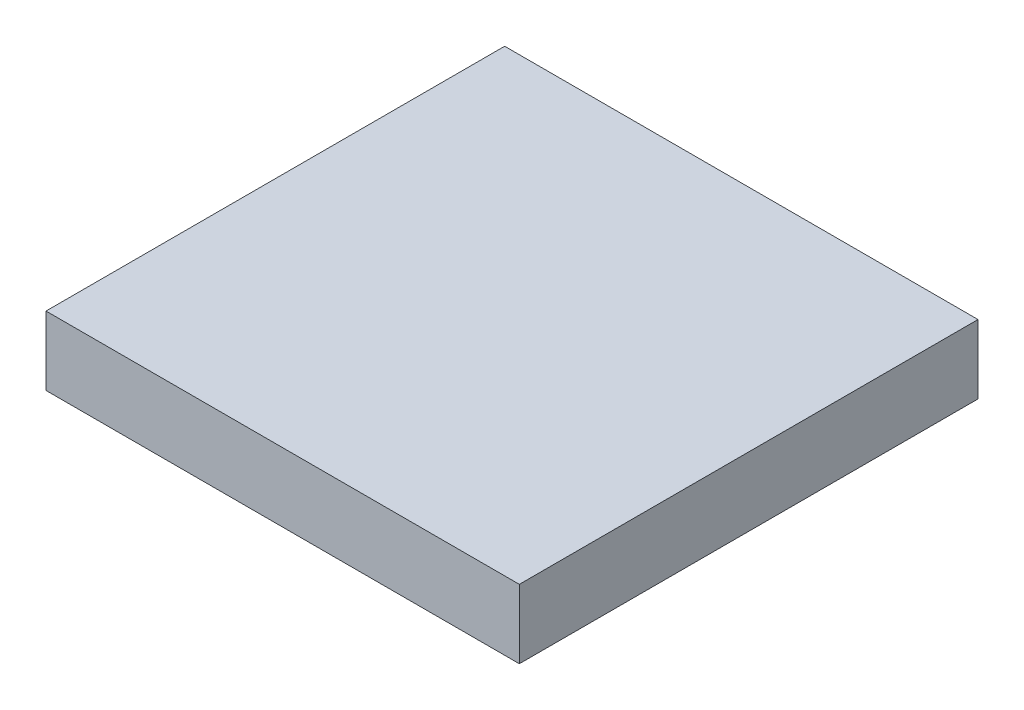
from build123d import *

# Parameters (mm, degrees)
SKETCH1_W           = 206.4
SKETCH1_H           = 200
BOSS_EXTRUDE1_DEPTH = 30


with BuildPart() as part:
    # Sketch1 → Boss-Extrude1 (new body)
    with BuildSketch(Plane(origin=(0, 0, 0), x_dir=(1, 0, 0), z_dir=(0, 1, 0))):
        with Locations((0.2, 0)):
            Rectangle(SKETCH1_W, SKETCH1_H)
    extrude(amount=BOSS_EXTRUDE1_DEPTH)


solid = part.part
